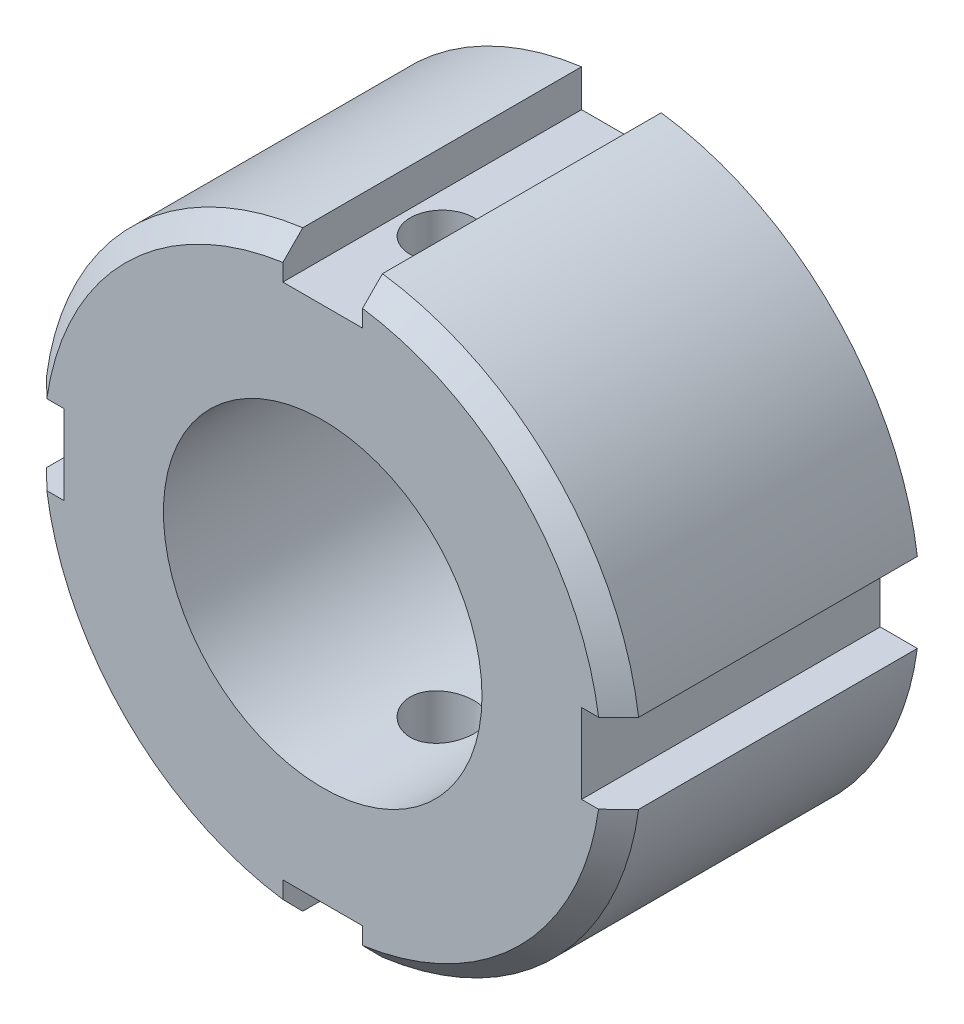
from build123d import *

# Parameters (mm, degrees)
SKETCH1_R           = 15
SKETCH1_R_2         = 8
BOSS_EXTRUDE1_DEPTH = 15
SKETCH2_W           = 4
SKETCH2_H           = 4
CUT_EXTRUDE1_DEPTH  = 26.980762114
CHAMFER1_SIZE       = 1
SKETCH3_R           = 1.600526218
CUT_EXTRUDE2_DEPTH  = 35.964521839


with BuildPart() as part:
    # Sketch1 → Boss-Extrude1 (new body)
    with BuildSketch(Plane.XY):
        Circle(SKETCH1_R)
        Circle(SKETCH1_R_2, mode=Mode.SUBTRACT)
    extrude(amount=BOSS_EXTRUDE1_DEPTH)

    # Sketch2 → Cut-Extrude1 (cut, through all)
    with BuildSketch(Plane.XY.offset(15)):
        with Locations((15, 0)):
            Rectangle(SKETCH2_W, SKETCH2_H)
        with Locations((0, 15)):
            Rectangle(SKETCH2_W, SKETCH2_H)
        with Locations((0, -15)):
            Rectangle(SKETCH2_W, SKETCH2_H)
        with Locations((-15, 0)):
            Rectangle(SKETCH2_W, SKETCH2_H)
    extrude(amount=-CUT_EXTRUDE1_DEPTH, mode=Mode.SUBTRACT)

    # Chamfer1
    chamfer1_edges = [part.edges().sort_by_distance(p)[0] for p in [
        (-10.606601718, 10.606601718, 15),
        (-10.606601718, -10.606601718, 15),
        (10.606601718, -10.606601718, 15),
        (10.606601718, 10.606601718, 15),
    ]]
    chamfer(chamfer1_edges, length=CHAMFER1_SIZE)

    # Sketch3 → Cut-Extrude2 (cut, through all)
    with BuildSketch(Plane(origin=(0, 13, 0), x_dir=(1, 0, 0), z_dir=(0, 1, 0))):
        with Locations(Location((0, -9, 0), (0, 0, 270))):
            Circle(SKETCH3_R)
    extrude(amount=-CUT_EXTRUDE2_DEPTH, mode=Mode.SUBTRACT)


solid = part.part
